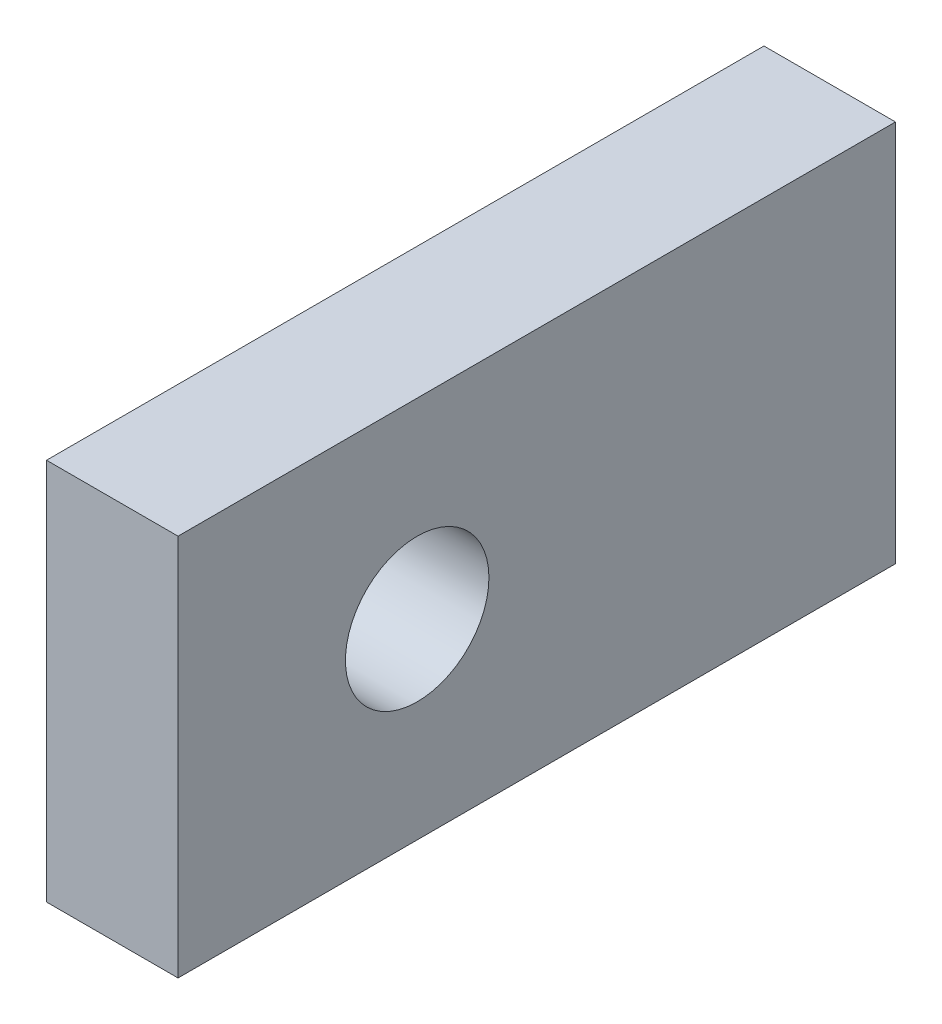
from build123d import *

# Parameters (mm, degrees)
SKETCH_1_W          = 15
SKETCH_1_H          = 8
EXTRUDE_1_DEPTH     = 3.25
SKETCH_2_R          = 1.5
CUT_EXTRUDE_1_DEPTH = 10.100137362
CHAMFER_1_SIZE      = 0.5


with BuildPart() as part:
    # 草图1 → 凸台-拉伸1 (new body)
    with BuildSketch(Plane(origin=(0, 0, 0), x_dir=(0, 0, -1), z_dir=(1, 0, 0))):
        Rectangle(SKETCH_1_W, SKETCH_1_H)
    extrude(amount=EXTRUDE_1_DEPTH)

    # 草图2 → 切除-拉伸1 (cut, through all)
    with BuildSketch(Plane(origin=(3.25, 0, 0), x_dir=(0, 0, -1), z_dir=(1, 0, 0))):
        with Locations((-2.5, 0)):
            Circle(SKETCH_2_R)
    extrude(amount=-CUT_EXTRUDE_1_DEPTH, mode=Mode.SUBTRACT)

    # 倒角1
    chamfer_1_edges = [part.edges().sort_by_distance(p)[0] for p in [
        (0, 4, 0),
        (0, 0, -7.5),
        (0, -4, 0),
        (0, 0, 7.5),
    ]]
    chamfer(chamfer_1_edges, length=CHAMFER_1_SIZE)


solid = part.part
